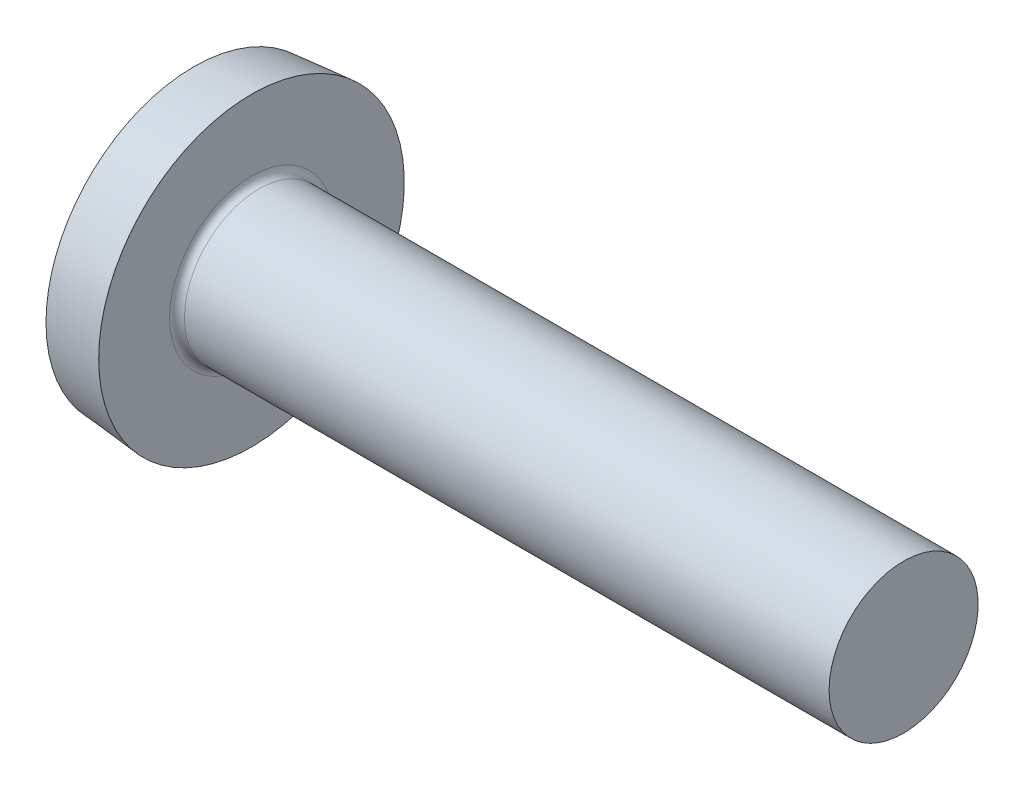
from build123d import *

# Parameters (mm, degrees)
FILLET1_R    = 0.4
RECPAT_COUNT = 2
RECPAT_ANGLE = 90


with BuildPart() as part:
    # BodySke → Base-Revolve (revolve)
    with BuildSketch(Plane.XY, mode=Mode.PRIVATE) as base_revolve_sk:
        with BuildLine():
            Line((4.8, 4), (4.8, 8.2))
            Line((4.8, 8.2), (4.79, 8.2))
            Line((4.79, 8.2), (1.7, 7.92966003))
            ThreePointArc((1.7, 7.92966003), (0.429774249, 4.054920104), (0, 0))
            Line((0, 0), (39.8, 0))
            Line((39.8, 0), (39.8, 4))
            Line((39.8, 4), (4.8, 4))
        make_face()
    revolve(base_revolve_sk.sketch.rotate(Axis((1.7, 0, 0), (1, 0, 0)), 90), axis=Axis((1.7, 0, 0), (1, 0, 0)))

    # Fillet1
    fillet1_edges = [part.edges().sort_by_distance(p)[0] for p in [
        (4.8, 0, -4),
    ]]
    fillet(fillet1_edges, radius=FILLET1_R)

    # Sketch3 → Recess section 0
    with BuildSketch(Plane(origin=(0, 0, 0), x_dir=(0, 0, -1), z_dir=(1, 0, 0))):
        with BuildLine():
            Line((0.71, -3.9), (-0.71, -3.9))
            Line((-0.71, -3.9), (-0.71, 3.9))
            Line((-0.71, 3.9), (0.71, 3.9))
            Line((0.71, 3.9), (0.71, -3.9))
        make_face()
    # Sketch4 → Recess section 1
    with BuildSketch(Plane(origin=(4.36, 0, 0), x_dir=(0, 0, -1), z_dir=(1, 0, 0))):
        with BuildLine():
            Line((0.71, -1.726184552), (-0.71, -1.726184552))
            Line((-0.71, -1.726184552), (-0.71, 1.726184552))
            Line((-0.71, 1.726184552), (0.71, 1.726184552))
            Line((0.71, 1.726184552), (0.71, -1.726184552))
        make_face()
    recess = loft(mode=Mode.SUBTRACT)

    # RecPat: Recess ×2 about axis
    recpat_axis = Axis((0, 0, 0), (1, 0, 0))
    for i in range(1, RECPAT_COUNT):
        add(recess.rotate(recpat_axis, i * RECPAT_ANGLE / (RECPAT_COUNT - 1)), mode=Mode.SUBTRACT)

    # RecCorSke → RecessCore (revolve, cut)
    with BuildSketch(Plane.XY, mode=Mode.PRIVATE) as recesscore_sk:
        Polygon((0, 0), (0, 1.5853809), (4.36, 1.2805), (4.776059671, 0), align=None)
    revolve(recesscore_sk.sketch.rotate(Axis((-3.175, 0, 0), (1, 0, 0)), 10.822716804), axis=Axis((-3.175, 0, 0), (1, 0, 0)), mode=Mode.SUBTRACT)


solid = part.part
